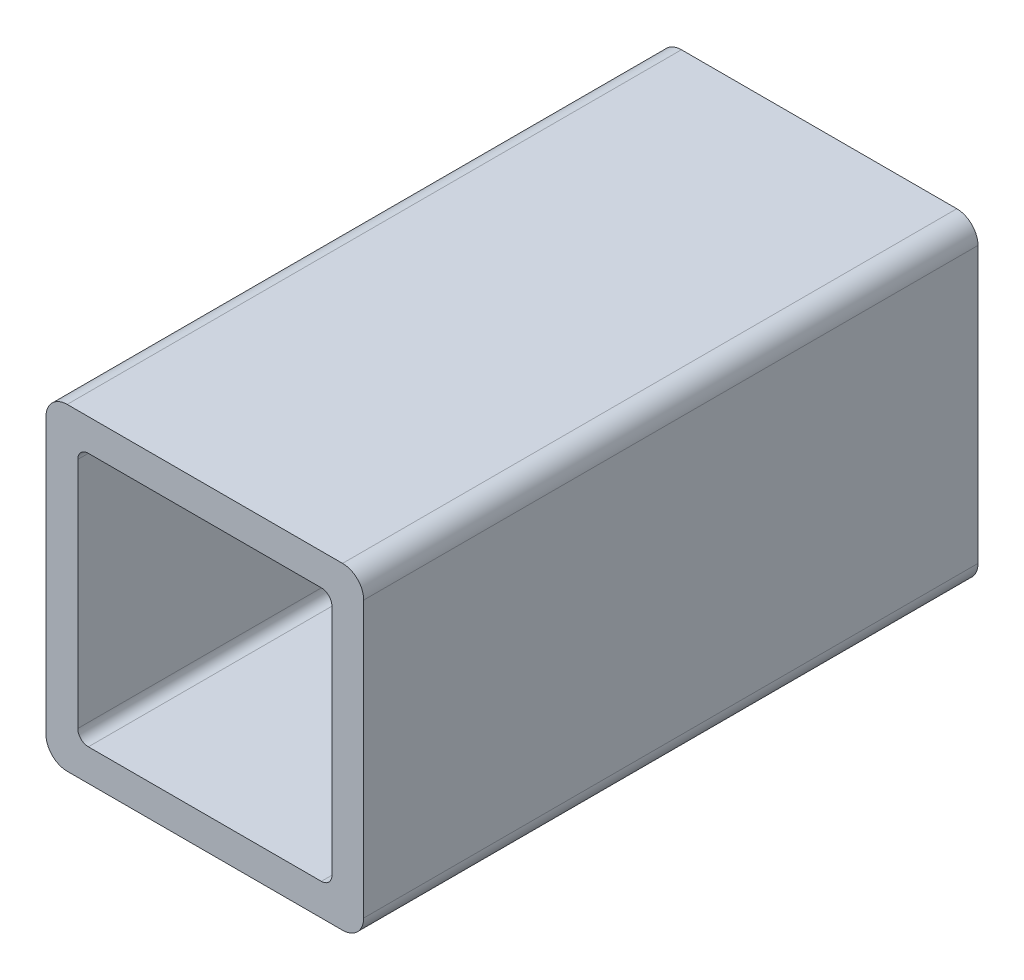
from build123d import *

# Parameters (mm, degrees)
DODANIE_WYCI_GNI_CIE1_DEPTH = 58


with BuildPart() as part:
    # Szkic1 → Dodanie-wyciągnięcie1 (new body)
    with BuildSketch(Plane.XY):
        with BuildLine():
            Line((2, 0), (28, 0))
            ThreePointArc((28, 0), (29.414213562, 0.585786438), (30, 2))
            Line((30, 2), (30, 28))
            ThreePointArc((30, 28), (29.414213562, 29.414213562), (28, 30))
            Line((28, 30), (2, 30))
            ThreePointArc((2, 30), (0.585786438, 29.414213562), (0, 28))
            Line((0, 28), (0, 2))
            ThreePointArc((0, 2), (0.585786438, 0.585786438), (2, 0))
        make_face()
        with BuildLine():
            Line((4, 3), (26, 3))
            ThreePointArc((26, 3), (26.707106781, 3.292893219), (27, 4))
            Line((27, 4), (27, 26))
            ThreePointArc((27, 26), (26.707106781, 26.707106781), (26, 27))
            Line((26, 27), (4, 27))
            ThreePointArc((4, 27), (3.292893219, 26.707106781), (3, 26))
            Line((3, 26), (3, 4))
            ThreePointArc((3, 4), (3.292893219, 3.292893219), (4, 3))
        make_face(mode=Mode.SUBTRACT)
    extrude(amount=DODANIE_WYCI_GNI_CIE1_DEPTH)


solid = part.part
